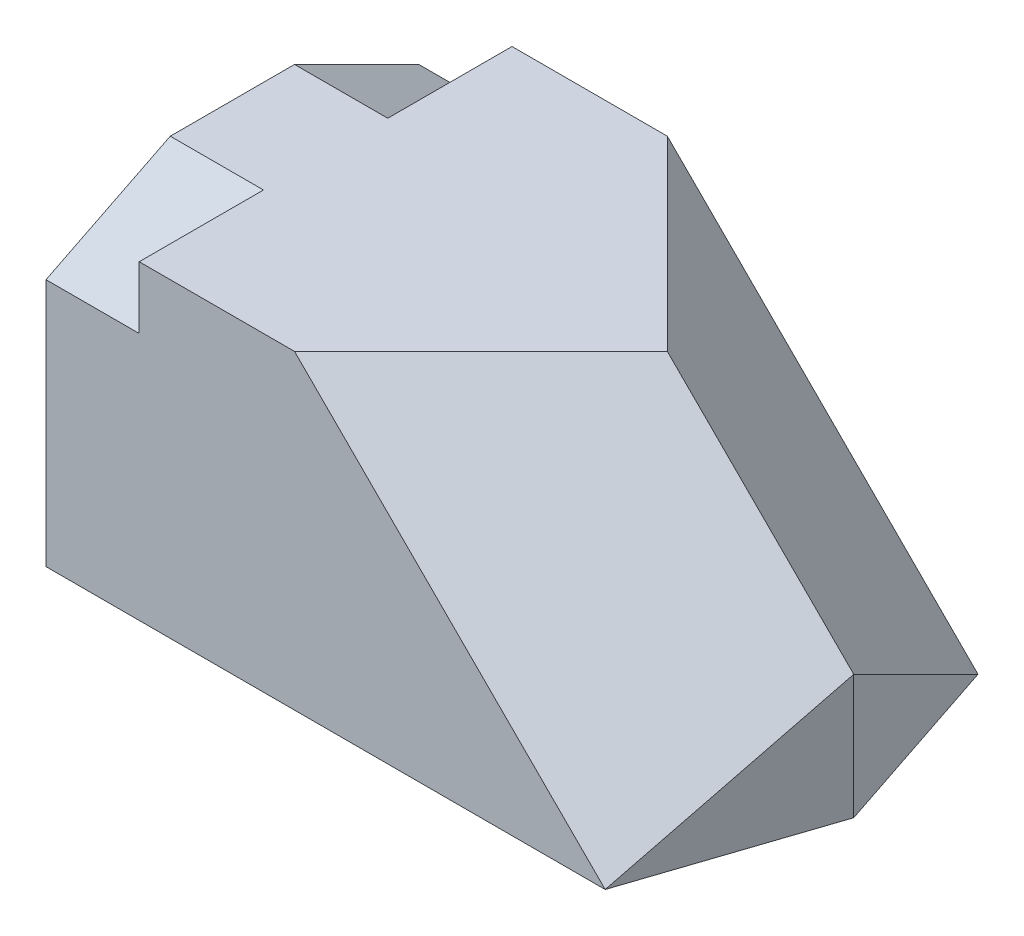
from build123d import *

# Parameters (mm, degrees)
CROQUIS2_W              = 100
CROQUIS2_H              = 50
SALIENTE_EXTRUIR1_DEPTH = 30
CORTAR_EXTRUIR1_DEPTH   = 15
CORTAR_EXTRUIR2_DEPTH   = 20
CORTAR_EXTRUIR3_DEPTH   = 165.121269


with BuildPart() as part:
    # Croquis2 → Saliente-Extruir1 (new, symmetric)
    with BuildSketch(Plane.XY):
        with Locations((50, 25)):
            Rectangle(CROQUIS2_W, CROQUIS2_H)
    extrude(amount=SALIENTE_EXTRUIR1_DEPTH, both=True)

    # Croquis3 → Cortar-Extruir1 (cut)
    with BuildSketch(Plane.ZY):
        Polygon((30, 50), (30, 40), (10, 50), align=None)
    cortar_extruir1 = extrude(amount=-CORTAR_EXTRUIR1_DEPTH, mode=Mode.SUBTRACT)

    # Croquis4 → Cortar-Extruir2 (cut)
    with BuildSketch(Plane.XZ):
        Polygon((100, 0), (90, 30), (100, 30), align=None)
    cortar_extruir2 = extrude(amount=-CORTAR_EXTRUIR2_DEPTH, mode=Mode.SUBTRACT)

    # Croquis6 → Cortar-Extruir3 (cut, through all, along a direction that is not the sketch's normal)
    with BuildSketch(Plane(origin=(0, 50, 0), x_dir=(1, 0, 0), z_dir=(0, 1, 0))):
        Polygon((100, 0), (70, 0), (40, -30), (100, -30), align=None)
    cortar_extruir3 = extrude(amount=-CORTAR_EXTRUIR3_DEPTH, dir=(-0.7071067811865475, 0.7071067811865476, 0), mode=Mode.SUBTRACT)

    # Simetría1: Cortar-Extruir1, Cortar-Extruir2, Cortar-Extruir3 across plane
    add(cortar_extruir1.mirror(Plane.XY), mode=Mode.SUBTRACT)
    add(cortar_extruir2.mirror(Plane.XY), mode=Mode.SUBTRACT)
    add(cortar_extruir3.mirror(Plane.XY), mode=Mode.SUBTRACT)


solid = part.part
